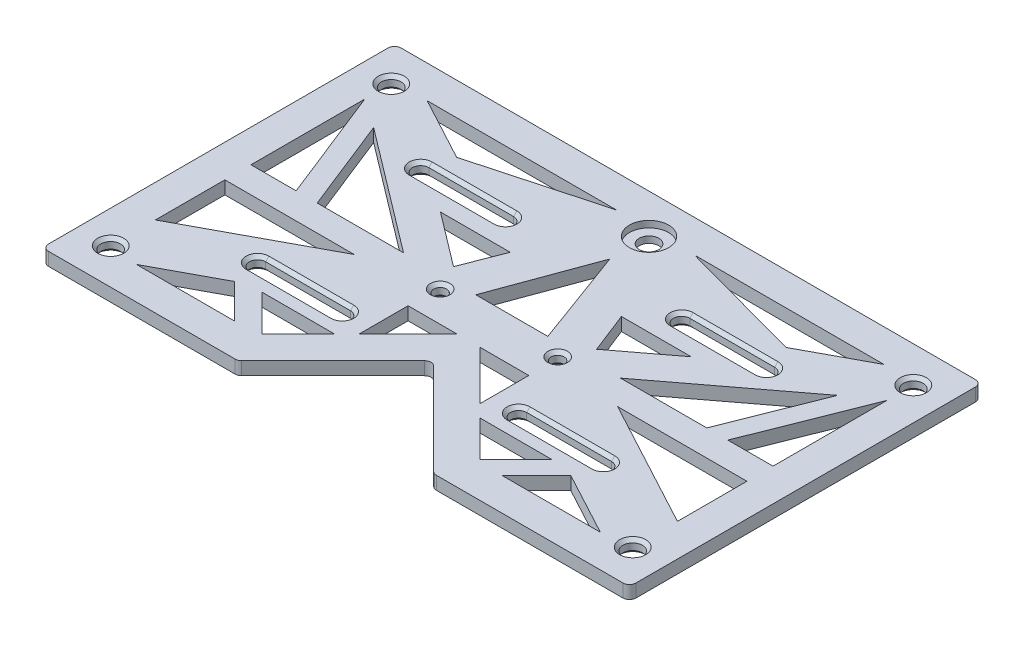
from build123d import *

# Parameters (mm, degrees)
SKETCH_1_R          = 1.5
SKETCH_1_R_2        = 1
EXTRUDE_1_DEPTH     = 2
SKETCH_3_R          = 3
CUT_EXTRUDE_2_DEPTH = 1
CUT_EXTRUDE_3_DEPTH = 2
FILLET_3_R          = 1
CHAMFER_2_SIZE      = 0.5


with BuildPart() as part:
    # 草图1 → 凸台-拉伸1 (new body)
    with BuildSketch(Plane(origin=(0, 0, 0), x_dir=(1, 0, 0), z_dir=(0, 1, 0))):
        Polygon((-45, 26.899531218), (45, 26.899531218), (45, -27.100468782), (15, -27.100468782), (0, -12.100468782), (-15, -27.100468782), (-45, -27.100468782), align=None)
        with Locations(Location((-40, 21.399531218, 0), (0, 0, 270))):
            Circle(SKETCH_1_R, mode=Mode.SUBTRACT)
        with Locations(Location((-40, -21.600468782, 0), (0, 0, 270))):
            Circle(SKETCH_1_R, mode=Mode.SUBTRACT)
        with Locations(Location((40, 21.399531218, 0), (0, 0, 270))):
            Circle(SKETCH_1_R, mode=Mode.SUBTRACT)
        with Locations(Location((40, -21.600468782, 0), (0, 0, 270))):
            Circle(SKETCH_1_R, mode=Mode.SUBTRACT)
        with Locations(Location((-9, -2.100468782, 0), (0, 0, 270))):
            Circle(SKETCH_1_R_2, mode=Mode.SUBTRACT)
        with Locations(Location((9, -2.100468782, 0), (0, 0, 270))):
            Circle(SKETCH_1_R_2, mode=Mode.SUBTRACT)
        with Locations(Location((0, 20.899531218, 0), (0, 0, 270))):
            Circle(SKETCH_1_R, mode=Mode.SUBTRACT)
        with BuildLine():
            Line((-26.5, 13.649531218), (-13.5, 13.649531218))
            ThreePointArc((-13.5, 13.649531218), (-12.25, 12.399531218), (-13.5, 11.149531218))
            Line((-13.5, 11.149531218), (-26.5, 11.149531218))
            ThreePointArc((-26.5, 11.149531218), (-27.75, 12.399531218), (-26.5, 13.649531218))
        make_face(mode=Mode.SUBTRACT)
        with BuildLine():
            Line((-26.5, -11.350468782), (-13.5, -11.350468782))
            ThreePointArc((-13.5, -11.350468782), (-12.25, -12.600468782), (-13.5, -13.850468782))
            Line((-13.5, -13.850468782), (-26.5, -13.850468782))
            ThreePointArc((-26.5, -13.850468782), (-27.75, -12.600468782), (-26.5, -11.350468782))
        make_face(mode=Mode.SUBTRACT)
        with BuildLine():
            Line((13.5, 13.649531218), (26.5, 13.649531218))
            ThreePointArc((26.5, 13.649531218), (27.75, 12.399531218), (26.5, 11.149531218))
            Line((26.5, 11.149531218), (13.5, 11.149531218))
            ThreePointArc((13.5, 11.149531218), (12.25, 12.399531218), (13.5, 13.649531218))
        make_face(mode=Mode.SUBTRACT)
        with BuildLine():
            Line((13.5, -11.350468782), (26.5, -11.350468782))
            ThreePointArc((26.5, -11.350468782), (27.75, -12.600468782), (26.5, -13.850468782))
            Line((26.5, -13.850468782), (13.5, -13.850468782))
            ThreePointArc((13.5, -13.850468782), (12.25, -12.600468782), (13.5, -11.350468782))
        make_face(mode=Mode.SUBTRACT)
    extrude(amount=EXTRUDE_1_DEPTH)

    # 草图3 → 切除-拉伸2 (cut)
    with BuildSketch(Plane(origin=(0, 2, 0), x_dir=(1, 0, 0), z_dir=(0, 1, 0))):
        with Locations(Location((0, 20.899531218, 0), (0, 0, 270))):
            Circle(SKETCH_3_R)
    extrude(amount=-CUT_EXTRUDE_2_DEPTH, mode=Mode.SUBTRACT)

    # 草图2 → 切除-拉伸3 (cut)
    with BuildSketch(Plane(origin=(0, 2, 0), x_dir=(1, 0, 0), z_dir=(0, 1, 0))):
        Polygon((-35.541259455, -22.100468782), (-20.523817595, -22.100468782), (-25.773817595, -16.850468782), align=None)
        Polygon((-16.67612236, -21.70552333), (-22.220805057, -16.160840633), (-11.131439663, -16.160840633), align=None)
        Polygon((-40, -14.747868465), (-20.190884311, -4.100468782), (-40, -4.100468782), align=None)
        Polygon((0, 14.899531218), (-5.519575922, -0.129010379), (5.519575922, -0.129010379), align=None)
        Polygon((-1.745892918, -6.775293888), (-9.25, -14.27940097), (-9.25, -6.775293888), align=None)
        Polygon((-35, 21.899531218), (-6, 21.899531218), (-25.23255814, 16.649531218), align=None)
        Polygon((-29.849319142, -0.100468782), (-35.54355148, 14.240560811), (-16.625597549, -0.100468782), align=None)
        Polygon((-40, 17.334853501), (-40, -0.100468782), (-33.077151446, -0.100468782), align=None)
        Polygon((-19.210594542, 8.149531218), (-8.520261517, 8.149531218), (-10.965913691, 1.899531218), align=None)
        Polygon((9.25, -14.27940097), (9.25, -6.775293888), (1.745892918, -6.775293888), align=None)
        Polygon((22.220805057, -16.160840633), (11.131439663, -16.160840633), (16.67612236, -21.70552333), align=None)
        Polygon((20.523817595, -22.100468782), (25.773817595, -16.850468782), (35.541259455, -22.100468782), align=None)
        Polygon((20.190884311, -4.100468782), (40, -4.100468782), (40, -14.747868465), align=None)
        Polygon((8.520261517, 8.149531218), (10.965913691, 1.899531218), (19.210594542, 8.149531218), align=None)
        Polygon((35.54355148, 14.240560811), (16.625597549, -0.100468782), (29.849319142, -0.100468782), align=None)
        Polygon((40, -0.100468782), (33.077151446, -0.100468782), (40, 17.334853501), align=None)
        Polygon((6, 21.899531218), (25.23255814, 16.649531218), (35, 21.899531218), align=None)
    extrude(amount=-CUT_EXTRUDE_3_DEPTH, mode=Mode.SUBTRACT)

    # 圆角3
    fillet_3_edges = [part.edges().sort_by_distance(p)[0] for p in [
        (-45, 1, -26.899531218),
        (45, 1, -26.899531218),
        (45, 1, 27.100468782),
        (15, 1, 27.100468782),
        (0, 1, 12.100468782),
        (-15, 1, 27.100468782),
        (-45, 1, 27.100468782),
    ]]
    fillet(fillet_3_edges, radius=FILLET_3_R)

    # 倒角2
    chamfer_2_edges = [part.edges().sort_by_distance(p)[0] for p in [
        (-27.75, 0, -12.399531218),
        (-20, 0, -11.149531218),
        (-12.25, 0, -12.399531218),
        (-20, 0, -13.649531218),
        (-27.75, 2, -12.399531218),
        (-20, 2, -11.149531218),
        (-12.25, 2, -12.399531218),
        (-20, 2, -13.649531218),
        (-27.75, 0, 12.600468782),
        (-20, 0, 13.850468782),
        (-12.25, 0, 12.600468782),
        (-20, 0, 11.350468782),
        (-27.75, 2, 12.600468782),
        (-20, 2, 13.850468782),
        (-12.25, 2, 12.600468782),
        (-20, 2, 11.350468782),
        (-9, 0, 1.100468782),
        (-9, 2, 1.100468782),
        (-40, 0, -22.899531218),
        (-40, 2, -22.899531218),
        (-40, 0, 20.100468782),
        (-40, 2, 20.100468782),
        (40, 0, -22.899531218),
        (40, 2, -22.899531218),
        (40, 0, 20.100468782),
        (40, 2, 20.100468782),
        (12.25, 0, -12.399531218),
        (20, 0, -11.149531218),
        (27.75, 0, -12.399531218),
        (20, 0, -13.649531218),
        (12.25, 2, -12.399531218),
        (20, 2, -11.149531218),
        (27.75, 2, -12.399531218),
        (20, 2, -13.649531218),
        (9, 0, 1.100468782),
        (9, 2, 1.100468782),
        (12.25, 0, 12.600468782),
        (20, 0, 13.850468782),
        (27.75, 0, 12.600468782),
        (20, 0, 11.350468782),
        (12.25, 2, 12.600468782),
        (20, 2, 13.850468782),
        (27.75, 2, 12.600468782),
        (20, 2, 11.350468782),
    ]]
    chamfer(chamfer_2_edges, length=CHAMFER_2_SIZE)


solid = part.part
